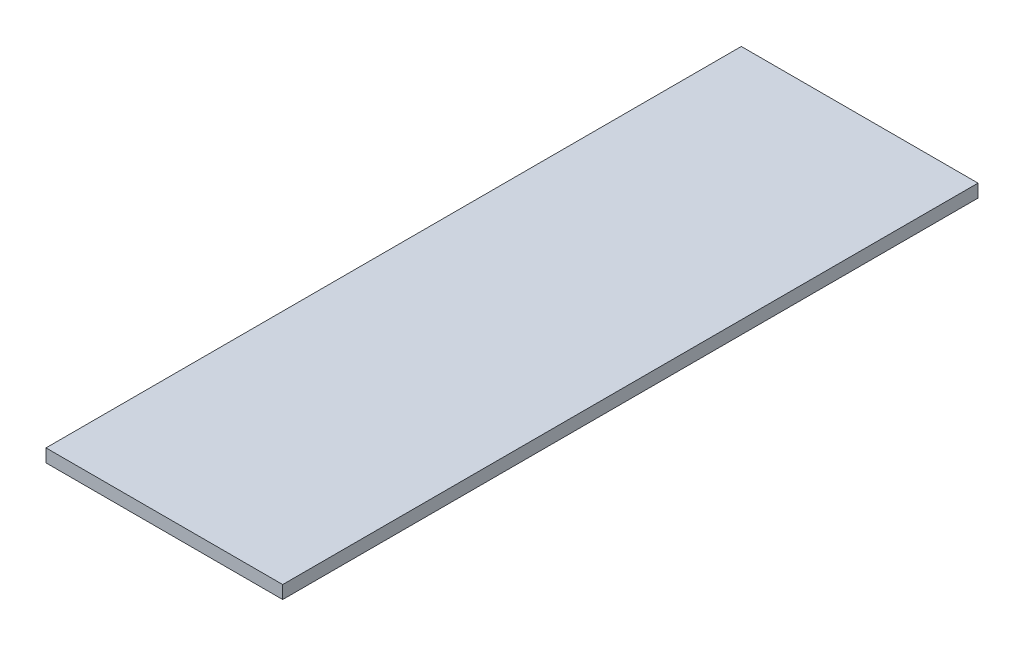
from build123d import *

# Parameters (mm, degrees)
SKETCH2_W           = 29.1
SKETCH2_H           = 85.48
BOSS_EXTRUDE1_DEPTH = 1.6


with BuildPart() as part:
    # Sketch2 → Boss-Extrude1 (new body)
    with BuildSketch(Plane(origin=(0, 0, 0), x_dir=(1, 0, 0), z_dir=(0, 1, 0))):
        with Locations((14.55, -42.74)):
            Rectangle(SKETCH2_W, SKETCH2_H)
    extrude(amount=BOSS_EXTRUDE1_DEPTH)


solid = part.part
